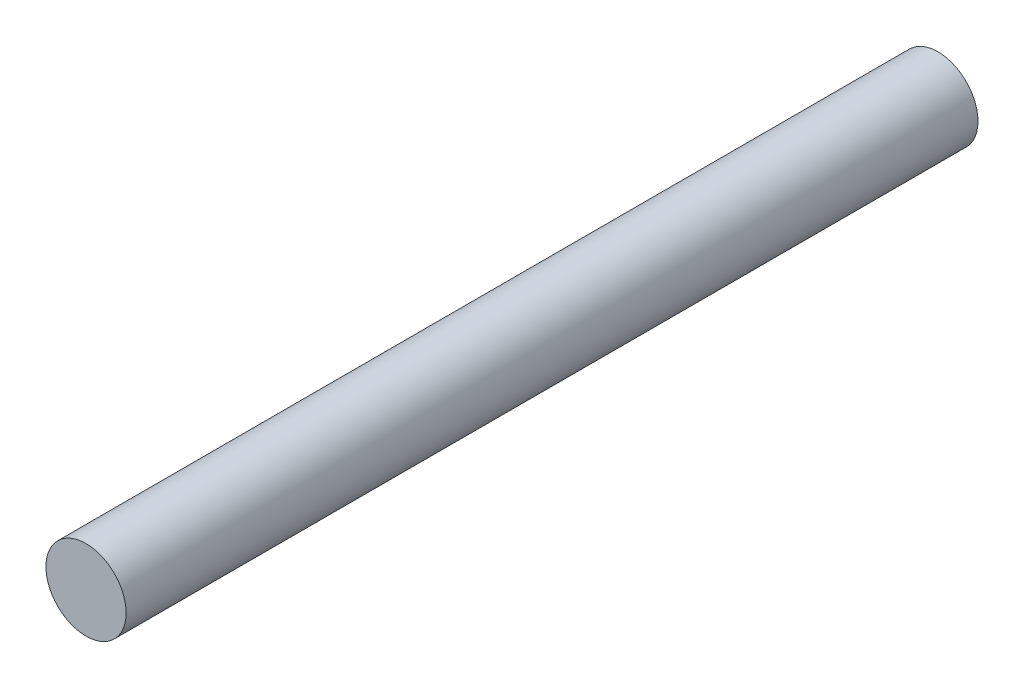
from build123d import *

# Parameters (mm, degrees)
SKETCH_1_R      = 2
EXTRUDE_1_DEPTH = 42.5


with BuildPart() as part:
    # Эскиз1 → Бобышка-Вытянуть1 (new body)
    with BuildSketch(Plane.XY):
        Circle(SKETCH_1_R)
    extrude(amount=EXTRUDE_1_DEPTH)


solid = part.part
